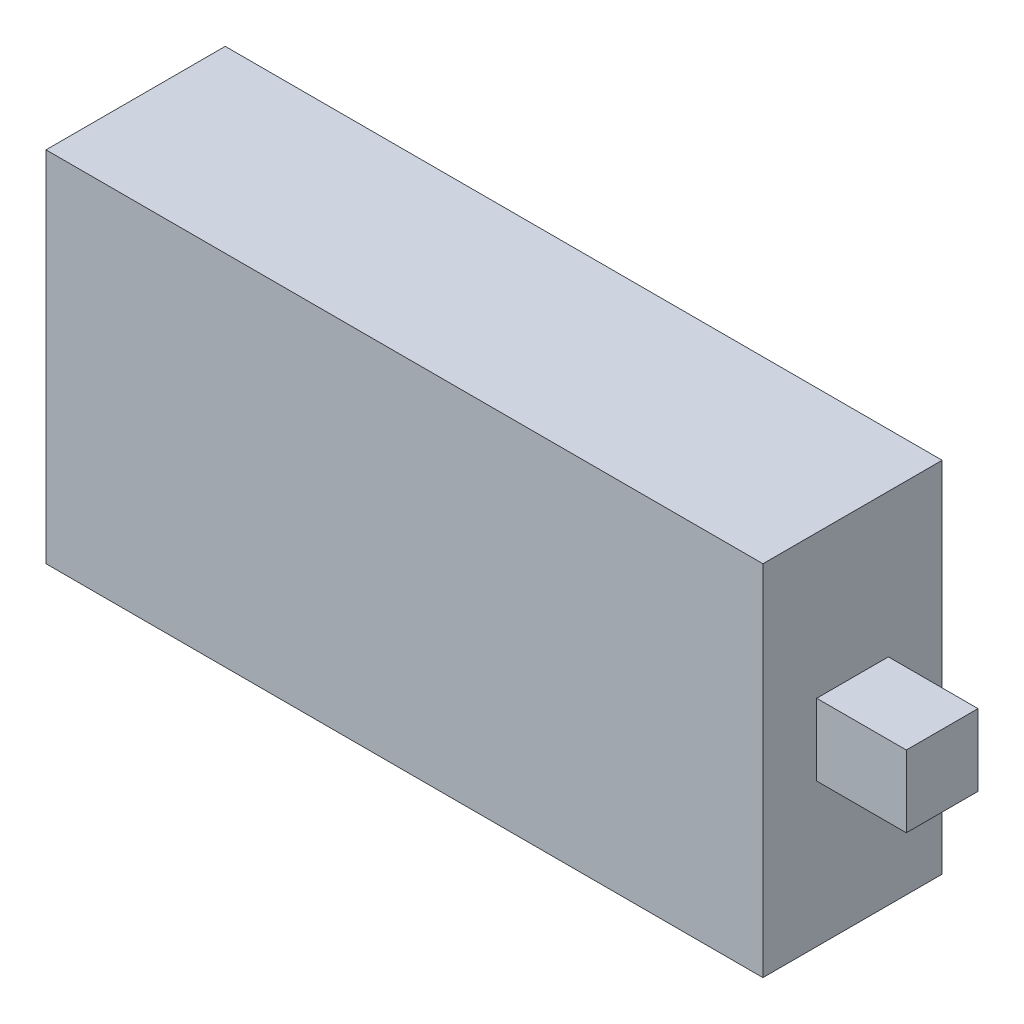
from build123d import *

# Parameters (mm, degrees)
SKETCH1_W           = 40
SKETCH1_H           = 20
BOSS_EXTRUDE1_DEPTH = 10
SKETCH2_W           = 4
SKETCH2_H           = 4
BOSS_EXTRUDE2_DEPTH = 5


with BuildPart() as part:
    # Sketch1 → Boss-Extrude1 (new body)
    with BuildSketch(Plane.XY):
        with Locations((20, 10)):
            Rectangle(SKETCH1_W, SKETCH1_H)
    extrude(amount=BOSS_EXTRUDE1_DEPTH)

    # Sketch2 → Boss-Extrude2 (add)
    with BuildSketch(Plane(origin=(40, 0, 0), x_dir=(0, 0, -1), z_dir=(1, 0, 0))):
        with Locations((-5, 10)):
            Rectangle(SKETCH2_W, SKETCH2_H)
    extrude(amount=BOSS_EXTRUDE2_DEPTH)


solid = part.part
